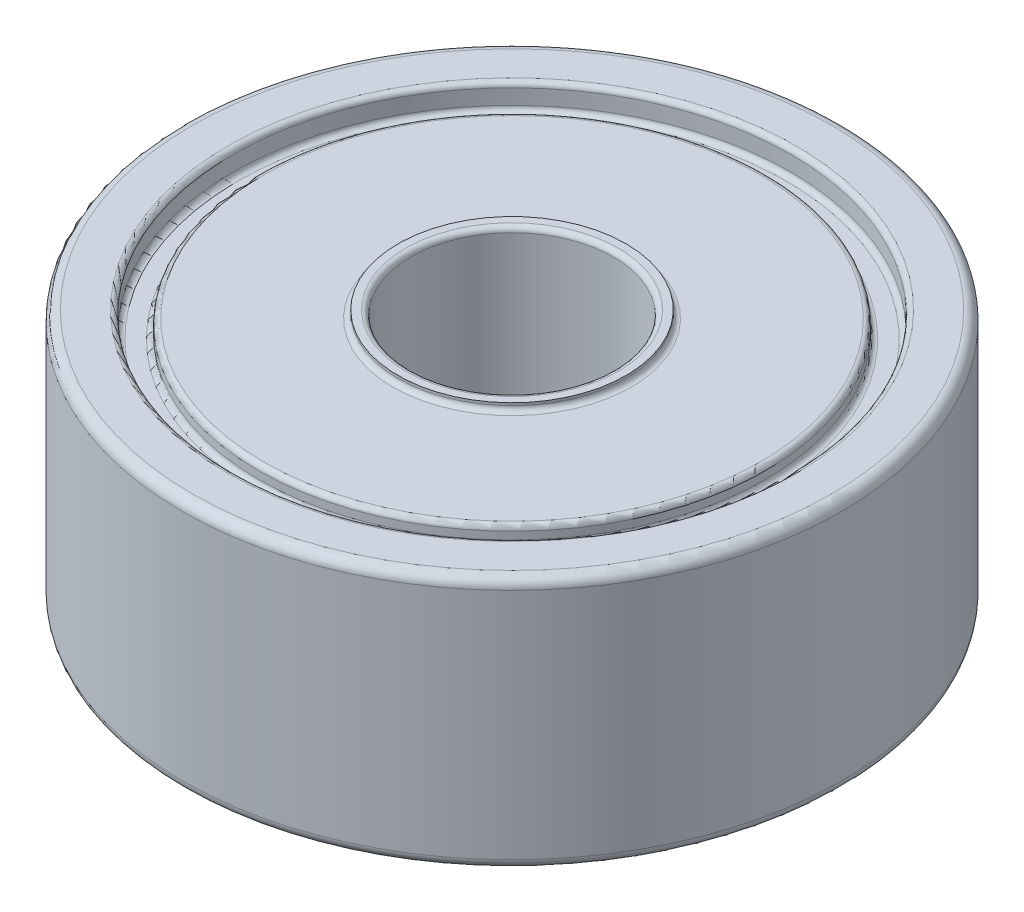
from build123d import *

# Parameters (mm, degrees)
SKETCH1_R           = 6.5
BOSS_EXTRUDE1_DEPTH = 2.5
SKETCH2_R           = 2
CUT_EXTRUDE1_DEPTH  = 5
FILLET1_R           = 0.2
FILLET3_R           = 0.1


with BuildPart() as part:
    # Sketch1 → Boss-Extrude1 (new, symmetric)
    with BuildSketch(Plane(origin=(0, 0, 0), x_dir=(1, 0, 0), z_dir=(0, 1, 0))):
        with Locations(Location((0, 0, 0), (0, 0, 270))):
            Circle(SKETCH1_R)
    extrude(amount=BOSS_EXTRUDE1_DEPTH, both=True)

    # Sketch2 → Cut-Extrude1 (cut)
    with BuildSketch(Plane(origin=(0, 2.5, 0), x_dir=(1, 0, 0), z_dir=(0, 1, 0))):
        with Locations(Location((0, 0, 0), (0, 0, 270))):
            Circle(SKETCH2_R)
    extrude(amount=-CUT_EXTRUDE1_DEPTH, mode=Mode.SUBTRACT)

    # Fillet1
    fillet1_edges = [part.edges().sort_by_distance(p)[0] for p in [
        (0, -2.5, -6.5),
        (0, 2.5, -6.5),
    ]]
    fillet(fillet1_edges, radius=FILLET1_R)

    # Sketch4 → Cut-Revolve1 (revolve, cut)
    with BuildSketch(Plane.XY, mode=Mode.PRIVATE) as cut_revolve1_sk:
        Polygon((-5.5, 2.5), (-5.5, 2), (-5, 2), (-5, 2.35), (-2.25, 2.35), (-2.25, 2.5), align=None)
    cut_revolve1 = revolve(cut_revolve1_sk.sketch.rotate(Axis((0, 0, 0), (0, 1, 0)), 270), axis=Axis((0, 0, 0), (0, 1, 0)), mode=Mode.SUBTRACT)

    # Mirror1: Cut-Revolve1 across plane
    add(cut_revolve1.mirror(Plane.ZX), mode=Mode.SUBTRACT)

    # Fillet3
    fillet3_edges = [part.edges().sort_by_distance(p)[0] for p in [
        (0, 2.5, 5.5),
        (0, 2, 5.5),
        (0, 2, 5),
        (0, 2.35, 5),
        (0, 2.35, 2.25),
        (0, -2, 5.5),
        (0, -2, 5),
        (0, -2.35, 5),
        (0, -2.5, -2),
        (0, 2.5, -2),
    ]]
    fillet(fillet3_edges, radius=FILLET3_R)


solid = part.part
